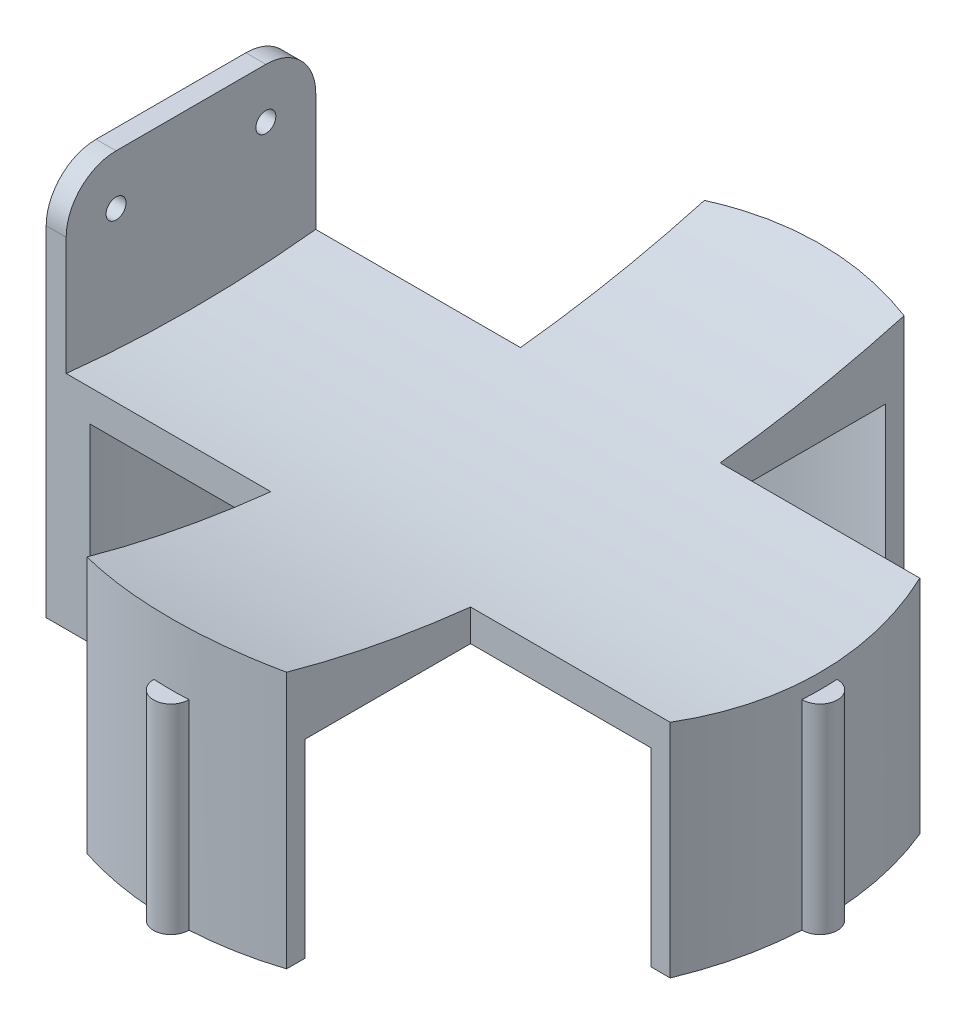
from build123d import *

# Parameters (mm, degrees)
SKETCH_1_W           = 50
SKETCH_1_H           = 40
EXTRUDE_1_DEPTH      = 4
SKETCH_2_R           = 2
CUT_EXTRUDE_1_DEPTH  = 4
EXTRUDE_2_DEPTH      = 180
CUT_EXTRUDE_START    = -60
CUT_EXTRUDE_2_DEPTH  = 60
CUT_EXTRUDE_3_DEPTH  = 60
EXTRUDE_3_REACH      = 191.95
EXTRUDE_3_END_RADIUS = 230
EXTRUDE_START        = 38
EXTRUDE_4_DEPTH      = 38
CUT_EXTRUDE_4_DEPTH  = 211.154705038
SKETCH_9_R           = 3.5
EXTRUDE_5_DEPTH      = 40
SKETCH_10_R          = 1.5
CUT_EXTRUDE_5_DEPTH  = 30
CHAMFER_1_SIZE       = 0.5
EXTRUDE_6_REACH      = 171.111
EXTRUDE_6_END_RADIUS = 235
EXTRUDE_7_REACH      = 171.111
FILLET_1_R           = 10


with BuildPart() as part:
    # 草图1 → 凸台-拉伸1 (new body)
    with BuildSketch(Plane(origin=(0, 0, 0), x_dir=(0, 0, -1), z_dir=(1, 0, 0))):
        with Locations((0, -20)):
            Rectangle(SKETCH_1_W, SKETCH_1_H)
    extrude(amount=EXTRUDE_1_DEPTH)

    # 草图2 → 切除-拉伸1 (cut)
    with BuildSketch(Plane(origin=(4, 0, 0), x_dir=(0, 0, -1), z_dir=(1, 0, 0))):
        with Locations((-15, -10)):
            Circle(SKETCH_2_R)
        with Locations((15, -10)):
            Circle(SKETCH_2_R)
    extrude(amount=-CUT_EXTRUDE_1_DEPTH, mode=Mode.SUBTRACT)

    # 草图3 → 凸台-拉伸2 (add)
    with BuildSketch(Plane(origin=(4, 0, 0), x_dir=(0, 0, -1), z_dir=(1, 0, 0))):
        with BuildLine():
            Line((-25, -33.637267303), (-25, -38.666428911))
            ThreePointArc((-25, -38.666428911), (0, -40), (25, -38.666428911))
            Line((25, -38.666428911), (25, -33.637267303))
            ThreePointArc((25, -33.637267303), (0, -35), (-25, -33.637267303))
        make_face()
    extrude(amount=EXTRUDE_2_DEPTH)

    # 草图4 → 切除-拉伸2 (cut)
    with BuildSketch(Plane(origin=(4, 0, 0), x_dir=(0, 0, -1), z_dir=(1, 0, 0)).offset(CUT_EXTRUDE_START)):
        with BuildLine():
            Line((25, -40), (25, -38.666428911))
            ThreePointArc((25, -38.666428911), (12.517771485, -39.666370401), (0, -40))
            Line((0, -40), (25, -40))
        make_face()
    extrude(amount=CUT_EXTRUDE_2_DEPTH, mode=Mode.SUBTRACT)

    # 草图5 → 切除-拉伸3 (cut)
    with BuildSketch(Plane(origin=(4, 0, 0), x_dir=(0, 0, -1), z_dir=(1, 0, 0)).offset(CUT_EXTRUDE_START)):
        with BuildLine():
            Line((-25, -38.666428911), (-25, -40))
            Line((-25, -40), (0, -40))
            ThreePointArc((0, -40), (-12.517771485, -39.666370401), (-25, -38.666428911))
        make_face()
    extrude(amount=CUT_EXTRUDE_3_DEPTH, mode=Mode.SUBTRACT)

    # 凸台-拉伸3: up to this cylinder (the profile starts outside it)
    extrude_3_end = Plane(origin=(65.000728, 195, 0), z_dir=(-1, 0, 0)) * Cylinder(EXTRUDE_3_END_RADIUS, 844.9, mode=Mode.PRIVATE)
    # 草图6 → 凸台-拉伸3 (add, up to the surface)
    with BuildSketch(Plane(origin=(0, -40, 0), x_dir=(-1, 0, 0), z_dir=(0, -1, 0)), mode=Mode.PRIVATE) as extrude_3_sk1:
        with BuildLine():
            Line((-85.002334196, 61.845829501), (-85.002334196, 25))
            Line((-85.002334196, 25), (-125, 25))
            ThreePointArc((-125, 25), (-130, 0), (-125, -25))
            Line((-125, -25), (-85.002334196, -25))
            Line((-85.002334196, -25), (-85.002334196, -61.845829501))
            ThreePointArc((-85.002334196, -61.845829501), (-65.002453212, -64.999999954), (-45.002334196, -61.84733917))
            Line((-45.002334196, -61.84733917), (-45.002334196, -25))
            Line((-45.002334196, -25), (-5, -25))
            ThreePointArc((-5, -25), (0, 0), (-5, 25))
            Line((-5, 25), (-45.002334196, 25))
            Line((-45.002334196, 25), (-45.002334196, 61.84733917))
            ThreePointArc((-45.002334196, 61.84733917), (-65.002453212, 64.999999954), (-85.002334196, 61.845829501))
        make_face()
    extrude_3_tool1 = extrude(extrude_3_sk1.sketch, amount=-EXTRUDE_3_REACH, mode=Mode.PRIVATE) - extrude_3_end
    extrude_3 = extrude_3_tool1.solids().sort_by_distance((65.000728, -40, 0))[0]
    add(extrude_3)

    # 镜向1: 凸台-拉伸3 across plane
    add(extrude_3.mirror(Plane.XY))

    # 草图7 → 凸台-拉伸4 (add)
    with BuildSketch(Plane.XZ.offset(40).offset(EXTRUDE_START)):
        with BuildLine():
            Line((5, -25), (8.810588186, -25))
            ThreePointArc((8.810588186, -25), (3.5, 0), (8.810588186, 25))
            Line((8.810588186, 25), (5, 25))
            ThreePointArc((5, 25), (1.26225608, 12.747548784), (0, 0))
            ThreePointArc((0, 0), (1.26225608, -12.747548784), (5, -25))
        make_face()
        with BuildLine():
            Line((45.002334196, -58.157917452), (45.002334196, -61.84733917))
            ThreePointArc((45.002334196, -61.84733917), (65.002453212, -64.999999954), (85.002334196, -61.845829501))
            Line((85.002334196, -61.845829501), (85.002334196, -58.156312011))
            ThreePointArc((85.002334196, -58.156312011), (65.002468367, -61.49999995), (45.002334196, -58.157917452))
        make_face()
        with BuildLine():
            Line((121.189411814, -25), (125, -25))
            ThreePointArc((125, -25), (128.73774392, -12.747548784), (130, 0))
            ThreePointArc((130, 0), (128.73774392, 12.747548784), (125, 25))
            Line((125, 25), (121.189411814, 25))
            ThreePointArc((121.189411814, 25), (126.5, 0), (121.189411814, -25))
        make_face()
        with BuildLine():
            Line((85.002334196, 58.156312011), (85.002334196, 61.845829501))
            ThreePointArc((85.002334196, 61.845829501), (65.002453212, 64.999999954), (45.002334196, 61.84733917))
            Line((45.002334196, 61.84733917), (45.002334196, 58.157917452))
            ThreePointArc((45.002334196, 58.157917452), (65.002468367, 61.49999995), (85.002334196, 58.156312011))
        make_face()
    extrude(amount=-EXTRUDE_4_DEPTH)

    # 草图8 → 切除-拉伸4 (cut, through all)
    with BuildSketch(Plane.XZ.offset(78)):
        with BuildLine():
            Line((184, 25), (125, 25))
            ThreePointArc((125, 25), (130, 0), (125, -25))
            Line((125, -25), (184, -25))
            Line((184, -25), (184, 25))
        make_face()
    extrude(amount=-CUT_EXTRUDE_4_DEPTH, mode=Mode.SUBTRACT)

    # 草图9 → 凸台-拉伸5 (add)
    with BuildSketch(Plane.XZ.offset(78)):
        with Locations((130, 0)):
            Circle(SKETCH_9_R)
        with Locations((65.002453212, -64.999999954)):
            Circle(SKETCH_9_R)
        with Locations((65.002453212, 64.999999954)):
            Circle(SKETCH_9_R)
    extrude(amount=-EXTRUDE_5_DEPTH)

    # 草图10 → 切除-拉伸5 (cut)
    with BuildSketch(Plane.XZ.offset(78)):
        with Locations(Location((65.002453212, 64.999999954, 0), (0, 0, 270))):
            Circle(SKETCH_10_R)
        with Locations(Location((130, 0, 0), (0, 0, 270))):
            Circle(SKETCH_10_R)
        with Locations(Location((65.002453212, -64.999999954, 0), (0, 0, 270))):
            Circle(SKETCH_10_R)
    extrude(amount=-CUT_EXTRUDE_5_DEPTH, mode=Mode.SUBTRACT)

    # 倒角1
    chamfer_1_edges = [part.edges().sort_by_distance(p)[0] for p in [
        (65.002453212, -78, 66.499999954),
        (130, -78, 1.5),
        (65.002453212, -78, -63.499999954),
    ]]
    chamfer(chamfer_1_edges, length=CHAMFER_1_SIZE)

    # 凸台-拉伸6: up to this cylinder (the profile starts outside it)
    extrude_6_end = Plane(origin=(1.489564, 195, 0), z_dir=(-1, 0, 0)) * Cylinder(EXTRUDE_6_END_RADIUS, 813.222, mode=Mode.PRIVATE)
    # 草图11 → 凸台-拉伸6 (add, up to the surface)
    with BuildSketch(Plane.XZ.offset(78), mode=Mode.PRIVATE) as extrude_6_sk1:
        with BuildLine():
            Line((0, 25), (0, 0))
            ThreePointArc((0, 0), (1.26225608, 12.747548784), (5, 25))
            Line((5, 25), (0, 25))
        make_face()
    extrude_6_tool1 = extrude(extrude_6_sk1.sketch, amount=-EXTRUDE_6_REACH, mode=Mode.PRIVATE) - extrude_6_end
    add(extrude_6_tool1.solids().sort_by_distance((1.489564, -78, 18.799089))[0])

    # 草图12 → 凸台-拉伸7 (add, up to next)
    with BuildSketch(Plane.XZ.offset(78), mode=Mode.PRIVATE) as extrude_7_sk1:
        with BuildLine():
            Line((0, -25), (5, -25))
            ThreePointArc((5, -25), (1.26225608, -12.747548784), (0, 0))
            Line((0, 0), (0, -25))
        make_face()
    extrude_7_tool1 = extrude(extrude_7_sk1.sketch, amount=-EXTRUDE_7_REACH, mode=Mode.PRIVATE) - part.part
    add(extrude_7_tool1.solids().sort_by_distance((1.489564, -78, -18.799089))[0])

    # 圆角1
    fillet_1_edges = [part.edges().sort_by_distance(p)[0] for p in [
        (2, 0, 25),
        (2, 0, -25),
    ]]
    fillet(fillet_1_edges, radius=FILLET_1_R)


solid = part.part
